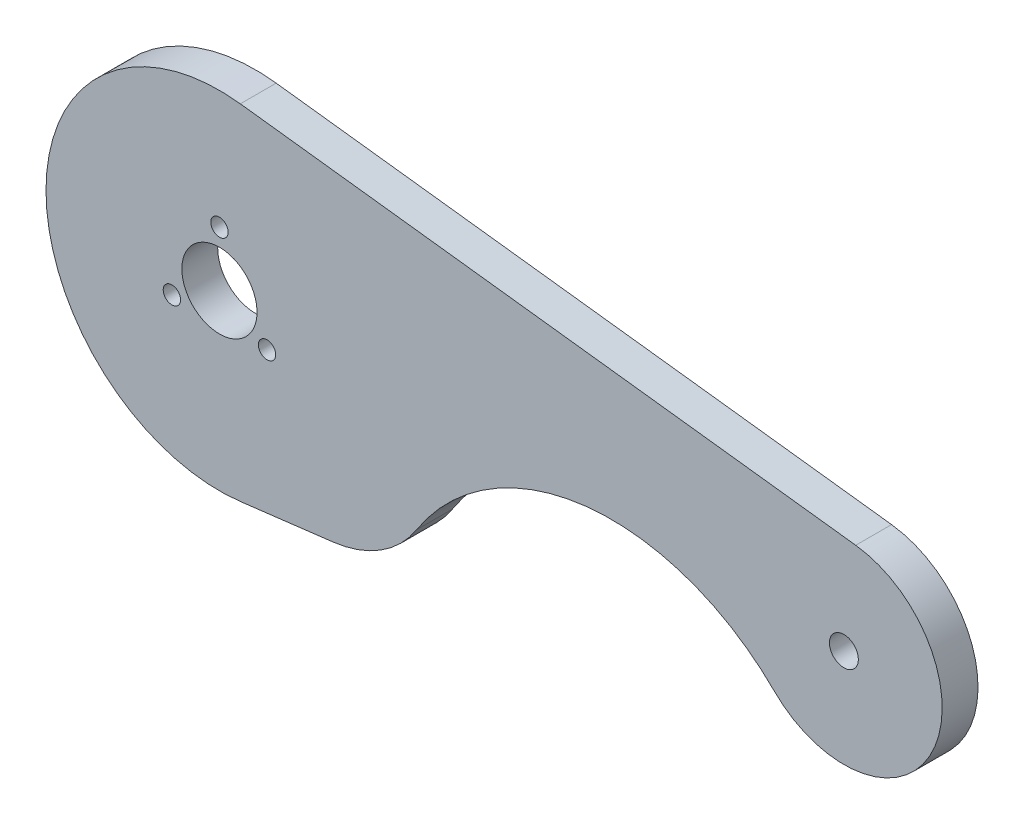
from build123d import *

# Parameters (mm, degrees)
SKETCH1_R           = 2.5
SKETCH1_R_2         = 6.5
BOSS_EXTRUDE1_DEPTH = 6.2
CUT_EXTRUDE1_REACH  = 130.699
SKETCH2_R           = 1.5


with BuildPart() as part:
    # Sketch1 → Boss-Extrude1 (new body)
    with BuildSketch(Plane.XY):
        with BuildLine():
            Line((3.611111111, -29.781871609), (19.668670355, -27.834860643))
            ThreePointArc((19.668670355, -27.834860643), (27.894571922, -24.919368692), (34.095743926, -18.778439145))
            ThreePointArc((34.095743926, -18.778439145), (63.437182893, -0.609540518), (96, -12.041594579))
            ThreePointArc((96, -12.041594579), (123.291552208, -7.427545426), (110.046296296, 16.876393912))
            Line((110.046296296, 16.876393912), (3.611111111, 29.781871609))
            ThreePointArc((3.611111111, 29.781871609), (-30, 0), (3.611111111, -29.781871609))
        make_face()
        with Locations(Location((108, 0, 0), (0, 0, 180))):
            Circle(SKETCH1_R, mode=Mode.SUBTRACT)
        with Locations(Location((0, 0, 0), (0, 0, 180))):
            Circle(SKETCH1_R_2, mode=Mode.SUBTRACT)
    extrude(amount=BOSS_EXTRUDE1_DEPTH)

    # Sketch2 → Cut-Extrude1 (cut, up to next)
    with BuildSketch(Plane(origin=(0, 0, 0), x_dir=(-1, 0, 0), z_dir=(0, 0, -1)), mode=Mode.PRIVATE) as cut_extrude1_sk1:
        with Locations((8.227241336, -4.75)):
            Circle(SKETCH2_R)
    cut_extrude1_tool1 = extrude(cut_extrude1_sk1.sketch, amount=-CUT_EXTRUDE1_REACH, mode=Mode.PRIVATE) & part.part
    # Sketch2 → Cut-Extrude1 (cut, up to next)
    with BuildSketch(Plane(origin=(0, 0, 0), x_dir=(-1, 0, 0), z_dir=(0, 0, -1)), mode=Mode.PRIVATE) as cut_extrude1_sk2:
        with Locations((-8.227241336, -4.75)):
            Circle(SKETCH2_R)
    cut_extrude1_tool2 = extrude(cut_extrude1_sk2.sketch, amount=-CUT_EXTRUDE1_REACH, mode=Mode.PRIVATE) & part.part
    # Sketch2 → Cut-Extrude1 (cut, up to next)
    with BuildSketch(Plane(origin=(0, 0, 0), x_dir=(-1, 0, 0), z_dir=(0, 0, -1)), mode=Mode.PRIVATE) as cut_extrude1_sk3:
        with Locations((0, 9.5)):
            Circle(SKETCH2_R)
    cut_extrude1_tool3 = extrude(cut_extrude1_sk3.sketch, amount=-CUT_EXTRUDE1_REACH, mode=Mode.PRIVATE) & part.part
    add(cut_extrude1_tool1.solids().sort_by_distance((-8.227241, -4.75, 0))[0], mode=Mode.SUBTRACT)
    add(cut_extrude1_tool2.solids().sort_by_distance((8.227241, -4.75, 0))[0], mode=Mode.SUBTRACT)
    add(cut_extrude1_tool3.solids().sort_by_distance((0, 9.5, 0))[0], mode=Mode.SUBTRACT)


solid = part.part
